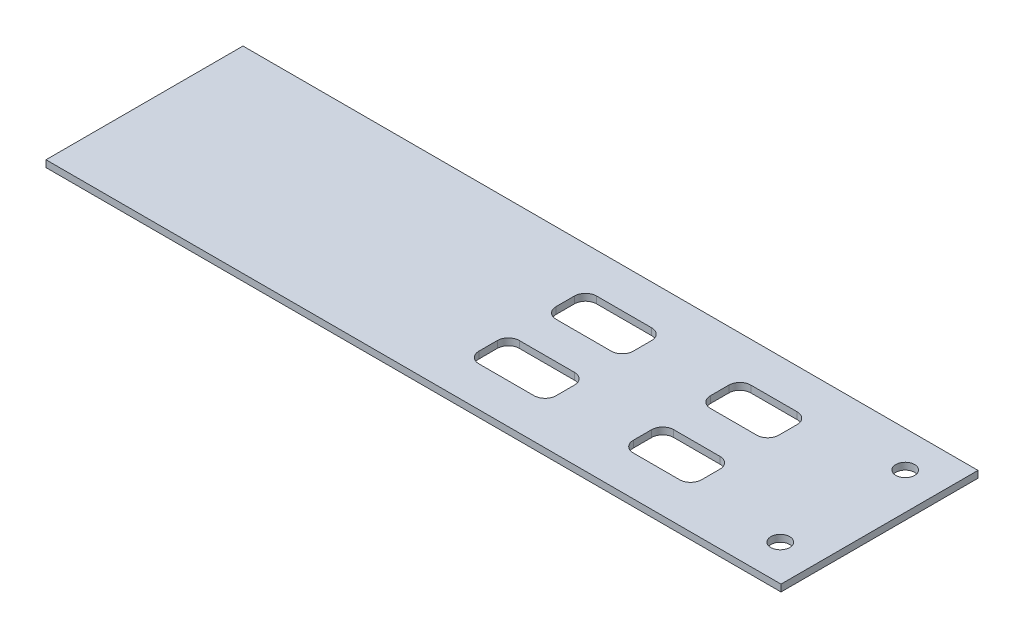
from build123d import *

# Parameters (mm, degrees)
SKETCH1_W           = 152.4
SKETCH1_H           = 68.072
BOSS_EXTRUDE1_DEPTH = 2.3622
SKETCH2_W           = 26.67
SKETCH2_H           = 13.97
SKETCH2_W_2         = 23.622
CUT_EXTRUDE1_DEPTH  = 167.92853912
FILLET1_R           = 3.81
SKETCH4_W           = 68.072
SKETCH4_H           = 2.3622
BOSS_EXTRUDE2_DEPTH = 101.6
SKETCH5_R           = 3.2639
CUT_EXTRUDE2_DEPTH  = 167.92853912


with BuildPart() as part:
    # Sketch1 → Boss-Extrude1 (new body)
    with BuildSketch(Plane(origin=(0, 0, 0), x_dir=(1, 0, 0), z_dir=(0, 1, 0))):
        with Locations((76.2, 34.036)):
            Rectangle(SKETCH1_W, SKETCH1_H)
    extrude(amount=BOSS_EXTRUDE1_DEPTH)

    # Sketch2 → Cut-Extrude1 (cut, through all)
    with BuildSketch(Plane(origin=(0, 2.3622, 0), x_dir=(1, 0, 0), z_dir=(0, 1, 0))):
        with Locations((43.815, 47.371)):
            Rectangle(SKETCH2_W, SKETCH2_H)
        with Locations((95.631, 47.371)):
            Rectangle(SKETCH2_W_2, SKETCH2_H)
        with Locations((43.815, 20.701)):
            Rectangle(SKETCH2_W, SKETCH2_H)
        with Locations((95.631, 20.701)):
            Rectangle(SKETCH2_W_2, SKETCH2_H)
    extrude(amount=-CUT_EXTRUDE1_DEPTH, mode=Mode.SUBTRACT)

    # Fillet1
    fillet1_edges = [part.edges().sort_by_distance(p)[0] for p in [
        (83.82, 1.1811, -40.386),
        (83.82, 1.1811, -54.356),
        (107.442, 1.1811, -54.356),
        (107.442, 1.1811, -40.386),
        (30.48, 1.1811, -13.716),
        (30.48, 1.1811, -27.686),
        (57.15, 1.1811, -27.686),
        (57.15, 1.1811, -13.716),
        (83.82, 1.1811, -13.716),
        (83.82, 1.1811, -27.686),
        (107.442, 1.1811, -27.686),
        (107.442, 1.1811, -13.716),
        (30.48, 1.1811, -40.386),
        (30.48, 1.1811, -54.356),
        (57.15, 1.1811, -54.356),
        (57.15, 1.1811, -40.386),
    ]]
    fillet(fillet1_edges, radius=FILLET1_R)

    # Sketch4 → Boss-Extrude2 (add)
    with BuildSketch(Plane.ZY):
        with Locations((-34.036, 1.1811)):
            Rectangle(SKETCH4_W, SKETCH4_H)
    extrude(amount=BOSS_EXTRUDE2_DEPTH)

    # Sketch5 → Cut-Extrude2 (cut, through all)
    with BuildSketch(Plane.XZ):
        with Locations(Location((139.7, -12.446, 0), (0, 0, 270))):
            Circle(SKETCH5_R)
        with Locations(Location((139.7, -55.626, 0), (0, 0, 270))):
            Circle(SKETCH5_R)
    extrude(amount=-CUT_EXTRUDE2_DEPTH, mode=Mode.SUBTRACT)


solid = part.part
